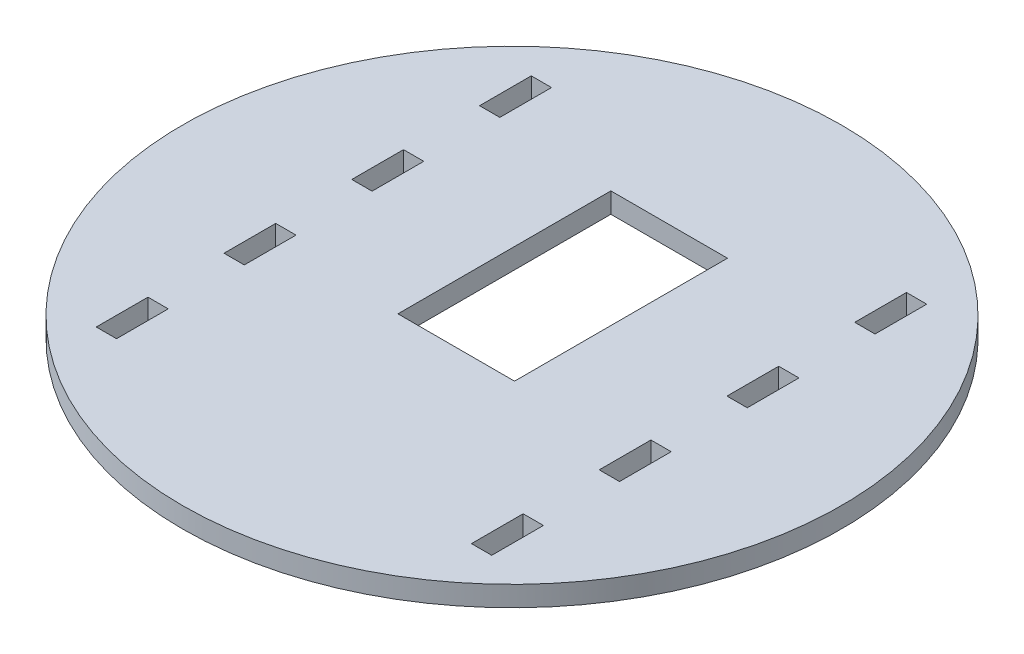
from build123d import *

# Parameters (mm, degrees)
CROQUIS2_R              = 65
SALIENTE_EXTRUIR1_DEPTH = 4
CORTAR_EXTRUIR6_REACH   = 94.011
CROQUIS3_W              = 4
CROQUIS3_H              = 10.2
CROQUIS4_W              = 23
CROQUIS4_H              = 42
CORTAR_EXTRUIR8_DEPTH   = 10


with BuildPart() as part:
    # Croquis2 → Saliente-Extruir1 (new body)
    with BuildSketch(Plane(origin=(0, 0, 0), x_dir=(1, 0, 0), z_dir=(0, 1, 0))):
        with Locations(Location((0, 0, 0), (0, 0, 270))):
            Circle(CROQUIS2_R)
    extrude(amount=SALIENTE_EXTRUIR1_DEPTH)

    # Croquis3 → Cortar-Extruir6 (cut, up to next)
    with BuildSketch(Plane(origin=(0, 4, 0), x_dir=(1, 0, 0), z_dir=(0, 1, 0)), mode=Mode.PRIVATE) as cortar_extruir6_sk1:
        with Locations((-37, 12.5)):
            Rectangle(CROQUIS3_W, CROQUIS3_H)
    cortar_extruir6_tool1 = extrude(cortar_extruir6_sk1.sketch, amount=-CORTAR_EXTRUIR6_REACH, mode=Mode.PRIVATE) & part.part
    # Croquis3 → Cortar-Extruir6 (cut, up to next)
    with BuildSketch(Plane(origin=(0, 4, 0), x_dir=(1, 0, 0), z_dir=(0, 1, 0)), mode=Mode.PRIVATE) as cortar_extruir6_sk2:
        with Locations((-37, -12.7)):
            Rectangle(CROQUIS3_W, CROQUIS3_H)
    cortar_extruir6_tool2 = extrude(cortar_extruir6_sk2.sketch, amount=-CORTAR_EXTRUIR6_REACH, mode=Mode.PRIVATE) & part.part
    # Croquis3 → Cortar-Extruir6 (cut, up to next)
    with BuildSketch(Plane(origin=(0, 4, 0), x_dir=(1, 0, 0), z_dir=(0, 1, 0)), mode=Mode.PRIVATE) as cortar_extruir6_sk3:
        with Locations((-37, -37.9)):
            Rectangle(CROQUIS3_W, CROQUIS3_H)
    cortar_extruir6_tool3 = extrude(cortar_extruir6_sk3.sketch, amount=-CORTAR_EXTRUIR6_REACH, mode=Mode.PRIVATE) & part.part
    # Croquis3 → Cortar-Extruir6 (cut, up to next)
    with BuildSketch(Plane(origin=(0, 4, 0), x_dir=(1, 0, 0), z_dir=(0, 1, 0)), mode=Mode.PRIVATE) as cortar_extruir6_sk4:
        with Locations((-37, 37.7)):
            Rectangle(CROQUIS3_W, CROQUIS3_H)
    cortar_extruir6_tool4 = extrude(cortar_extruir6_sk4.sketch, amount=-CORTAR_EXTRUIR6_REACH, mode=Mode.PRIVATE) & part.part
    # Croquis3 → Cortar-Extruir6 (cut, up to next)
    with BuildSketch(Plane(origin=(0, 4, 0), x_dir=(1, 0, 0), z_dir=(0, 1, 0)), mode=Mode.PRIVATE) as cortar_extruir6_sk5:
        with Locations((37, 37.7)):
            Rectangle(CROQUIS3_W, CROQUIS3_H)
    cortar_extruir6_tool5 = extrude(cortar_extruir6_sk5.sketch, amount=-CORTAR_EXTRUIR6_REACH, mode=Mode.PRIVATE) & part.part
    # Croquis3 → Cortar-Extruir6 (cut, up to next)
    with BuildSketch(Plane(origin=(0, 4, 0), x_dir=(1, 0, 0), z_dir=(0, 1, 0)), mode=Mode.PRIVATE) as cortar_extruir6_sk6:
        with Locations((37, 12.5)):
            Rectangle(CROQUIS3_W, CROQUIS3_H)
    cortar_extruir6_tool6 = extrude(cortar_extruir6_sk6.sketch, amount=-CORTAR_EXTRUIR6_REACH, mode=Mode.PRIVATE) & part.part
    # Croquis3 → Cortar-Extruir6 (cut, up to next)
    with BuildSketch(Plane(origin=(0, 4, 0), x_dir=(1, 0, 0), z_dir=(0, 1, 0)), mode=Mode.PRIVATE) as cortar_extruir6_sk7:
        with Locations((37, -12.7)):
            Rectangle(CROQUIS3_W, CROQUIS3_H)
    cortar_extruir6_tool7 = extrude(cortar_extruir6_sk7.sketch, amount=-CORTAR_EXTRUIR6_REACH, mode=Mode.PRIVATE) & part.part
    # Croquis3 → Cortar-Extruir6 (cut, up to next)
    with BuildSketch(Plane(origin=(0, 4, 0), x_dir=(1, 0, 0), z_dir=(0, 1, 0)), mode=Mode.PRIVATE) as cortar_extruir6_sk8:
        with Locations((37, -37.9)):
            Rectangle(CROQUIS3_W, CROQUIS3_H)
    cortar_extruir6_tool8 = extrude(cortar_extruir6_sk8.sketch, amount=-CORTAR_EXTRUIR6_REACH, mode=Mode.PRIVATE) & part.part
    add(cortar_extruir6_tool1.solids().sort_by_distance((-37, 4, -12.5))[0], mode=Mode.SUBTRACT)
    add(cortar_extruir6_tool2.solids().sort_by_distance((-37, 4, 12.7))[0], mode=Mode.SUBTRACT)
    add(cortar_extruir6_tool3.solids().sort_by_distance((-37, 4, 37.9))[0], mode=Mode.SUBTRACT)
    add(cortar_extruir6_tool4.solids().sort_by_distance((-37, 4, -37.7))[0], mode=Mode.SUBTRACT)
    add(cortar_extruir6_tool5.solids().sort_by_distance((37, 4, -37.7))[0], mode=Mode.SUBTRACT)
    add(cortar_extruir6_tool6.solids().sort_by_distance((37, 4, -12.5))[0], mode=Mode.SUBTRACT)
    add(cortar_extruir6_tool7.solids().sort_by_distance((37, 4, 12.7))[0], mode=Mode.SUBTRACT)
    add(cortar_extruir6_tool8.solids().sort_by_distance((37, 4, 37.9))[0], mode=Mode.SUBTRACT)

    # Croquis4 → Cortar-Extruir8 (cut)
    with BuildSketch(Plane(origin=(0, 4, 0), x_dir=(1, 0, 0), z_dir=(0, 1, 0))):
        with Locations((0, 10)):
            Rectangle(CROQUIS4_W, CROQUIS4_H)
    extrude(amount=-CORTAR_EXTRUIR8_DEPTH, mode=Mode.SUBTRACT)


solid = part.part
